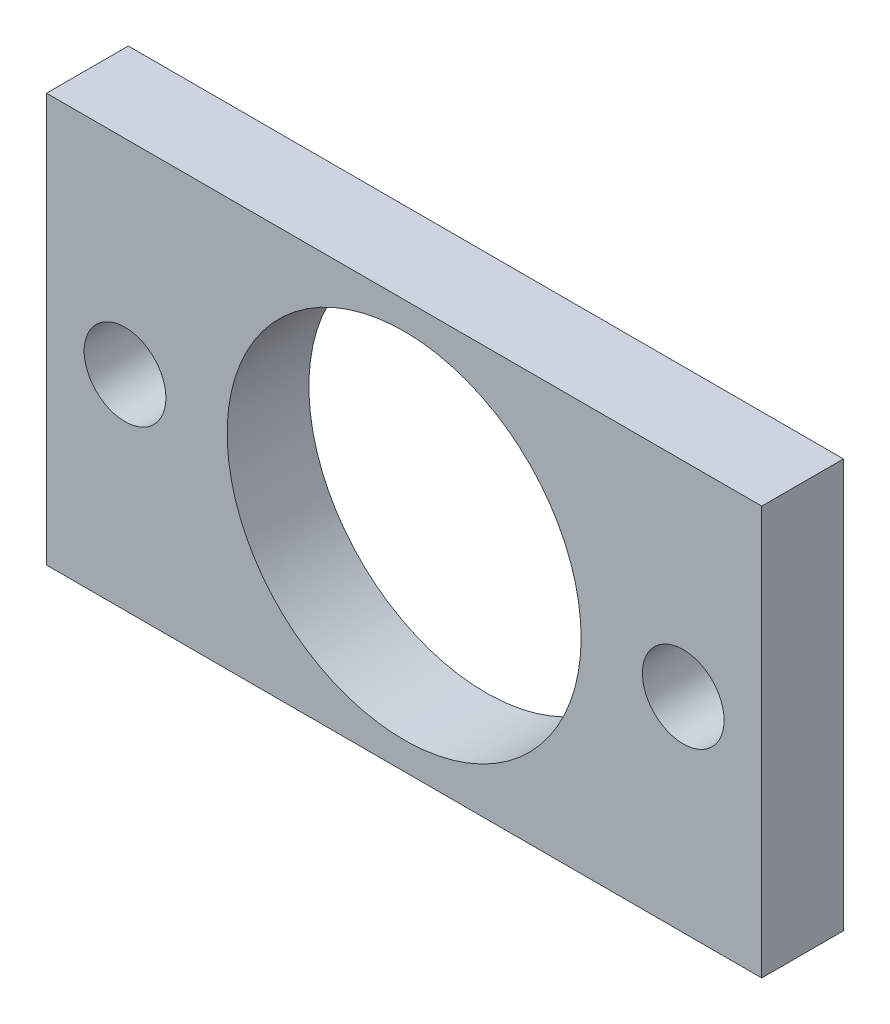
from build123d import *

# Parameters (mm, degrees)
SKETCH1_R           = 11
SKETCH1_R_2         = 2.54
BOSS_EXTRUDE1_DEPTH = 5.08


with BuildPart() as part:
    # Sketch1 → Boss-Extrude1 (new body)
    with BuildSketch(Plane.XY):
        Polygon((-15.875, 12.7), (-22.225, 12.7), (-22.225, -12.7), (-15.875, -12.7), (15.875, -12.7), (22.225, -12.7), (22.225, 12.7), (15.875, 12.7), align=None)
        Circle(SKETCH1_R, mode=Mode.SUBTRACT)
        with Locations((17.346281091, 0)):
            Circle(SKETCH1_R_2, mode=Mode.SUBTRACT)
        with Locations((-17.346281091, 0)):
            Circle(SKETCH1_R_2, mode=Mode.SUBTRACT)
    extrude(amount=BOSS_EXTRUDE1_DEPTH)


solid = part.part
